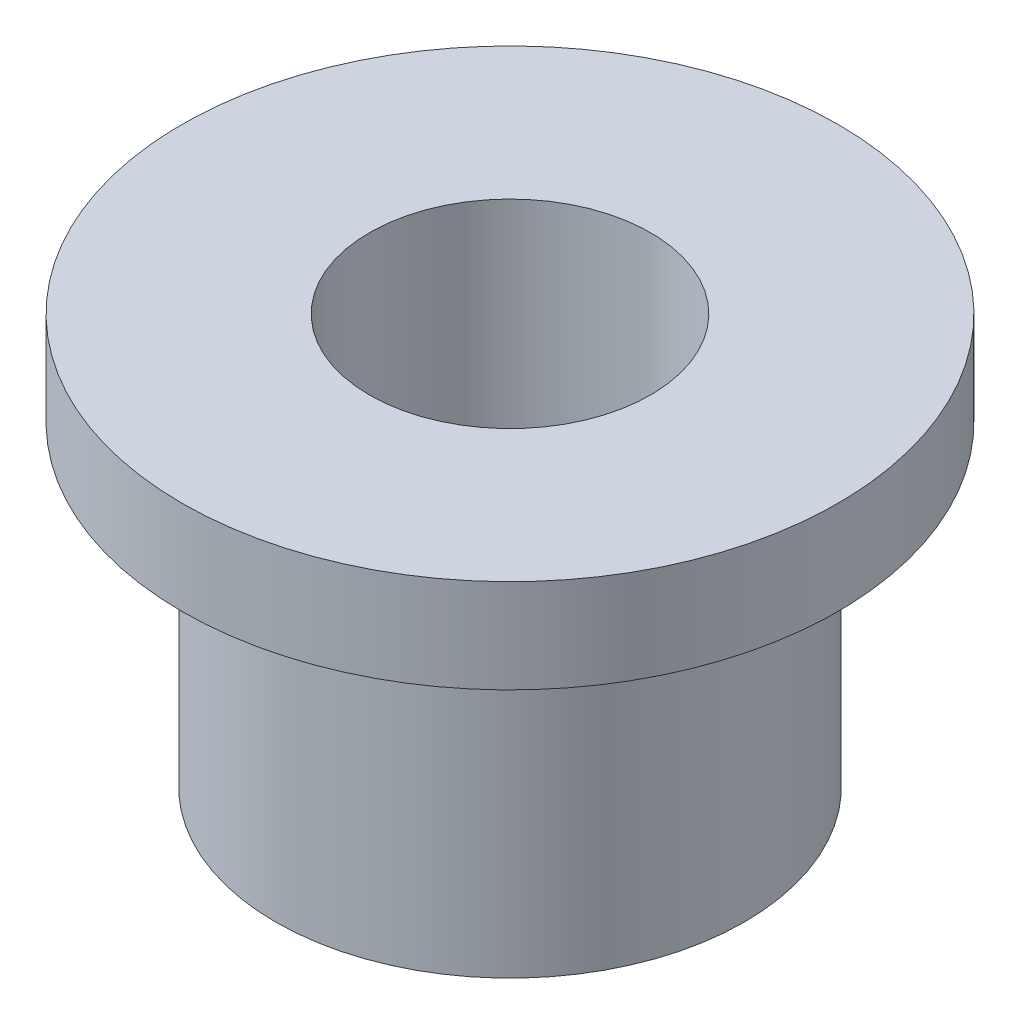
from build123d import *

# Parameters (mm, degrees)
SKETCH1_R           = 7.9375
SKETCH1_R_2         = 4.7625
BOSS_EXTRUDE1_DEPTH = 10.7
SKETCH2_R           = 11.1125
SKETCH2_R_2         = 4.7625
BOSS_EXTRUDE2_DEPTH = 3.175


with BuildPart() as part:
    # Sketch1 → Boss-Extrude1 (new body)
    with BuildSketch(Plane(origin=(0, 0, 0), x_dir=(1, 0, 0), z_dir=(0, 1, 0))):
        with Locations(Location((0, 0, 0), (0, 0, 270))):
            Circle(SKETCH1_R)
        with Locations(Location((0, 0, 0), (0, 0, 270))):
            Circle(SKETCH1_R_2, mode=Mode.SUBTRACT)
    extrude(amount=BOSS_EXTRUDE1_DEPTH)

    # Sketch2 → Boss-Extrude2 (add)
    with BuildSketch(Plane(origin=(0, 10.7, 0), x_dir=(1, 0, 0), z_dir=(0, 1, 0))):
        with Locations(Location((0, 0, 0), (0, 0, 270))):
            Circle(SKETCH2_R)
        with Locations(Location((0, 0, 0), (0, 0, 270))):
            Circle(SKETCH2_R_2, mode=Mode.SUBTRACT)
    extrude(amount=BOSS_EXTRUDE2_DEPTH)


solid = part.part
